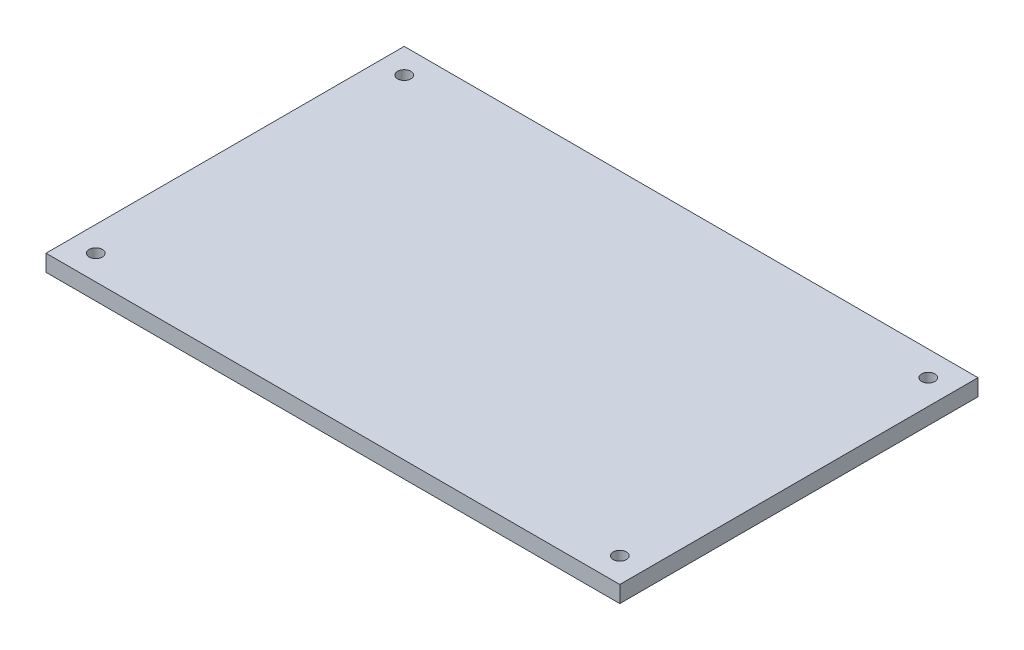
from build123d import *

# Parameters (mm, degrees)
SKETCH_1_W      = 173
SKETCH_1_H      = 108
SKETCH_1_R      = 2
EXTRUDE_1_DEPTH = 5
SKETCH_2_W      = 20
SKETCH_2_H      = 10.2
SKETCH_2_R      = 1.75
EXTRUDE_2_DEPTH = 30
FILLET_1_R      = 1
EXTRUDE_START   = 6.5
SKETCH_3_R      = 1.75
EXTRUDE_3_DEPTH = 6.5


with BuildPart() as part:
    # 草图1 → 凸台-拉伸1 (new body)
    with BuildSketch(Plane(origin=(0, 0, 0), x_dir=(1, 0, 0), z_dir=(0, 1, 0))):
        Rectangle(SKETCH_1_W, SKETCH_1_H)
        with Locations(Location((-79, 46.5, 0), (0, 0, 270))):
            Circle(SKETCH_1_R, mode=Mode.SUBTRACT)
        with Locations(Location((79, 46.5, 0), (0, 0, 90))):
            Circle(SKETCH_1_R, mode=Mode.SUBTRACT)
        with Locations(Location((79, -46.5, 0), (0, 0, 270))):
            Circle(SKETCH_1_R, mode=Mode.SUBTRACT)
        with Locations(Location((-79, -46.5, 0), (0, 0, 90))):
            Circle(SKETCH_1_R, mode=Mode.SUBTRACT)
    extrude(amount=EXTRUDE_1_DEPTH)

    # 草图2 → 凸台-拉伸2 (add)
    # profile 1 of 2: a face of its own
    with BuildSketch(Plane(origin=(0, 0, -54), x_dir=(-1, 0, 0), z_dir=(0, 0, -1))):
        with Locations((-32.5, -5.1)):
            Rectangle(SKETCH_2_W, SKETCH_2_H)
        with Locations((-32.5, -5.2)):
            Circle(SKETCH_2_R, mode=Mode.SUBTRACT)
    # profile 2 of 2: a face of its own
    with BuildSketch(Plane(origin=(0, 0, -54), x_dir=(-1, 0, 0), z_dir=(0, 0, -1))):
        with Locations((32.5, -5.1)):
            Rectangle(SKETCH_2_W, SKETCH_2_H)
        with Locations((32.5, -5.2)):
            Circle(SKETCH_2_R, mode=Mode.SUBTRACT)
    extrude(amount=-EXTRUDE_2_DEPTH)

    # 圆角1
    fillet_1_edges = [part.edges().sort_by_distance(p)[0] for p in [
        (42.5, -10.2, -39),
        (42.5, 0, -39),
        (22.5, 0, -39),
        (22.5, -10.2, -39),
        (-22.5, -10.2, -39),
        (-22.5, 0, -39),
        (-42.5, 0, -39),
        (-42.5, -10.2, -39),
    ]]
    fillet(fillet_1_edges, radius=FILLET_1_R)

    # 草图3 → 凸台-拉伸3 (add)
    # profile 1 of 2: a face of its own
    with BuildSketch(Plane.XY.offset(-24).offset(EXTRUDE_START)):
        with BuildLine():
            Line((23.5, -10.2), (41.5, -10.2))
            ThreePointArc((41.5, -10.2), (42.207106781, -9.907106781), (42.5, -9.2))
            Line((42.5, -9.2), (42.5, -1))
            ThreePointArc((42.5, -1), (42.792893219, -0.292893219), (43.5, 0))
            Line((43.5, 0), (21.5, 0))
            ThreePointArc((21.5, 0), (22.207106781, -0.292893219), (22.5, -1))
            Line((22.5, -1), (22.5, -9.2))
            ThreePointArc((22.5, -9.2), (22.792893219, -9.907106781), (23.5, -10.2))
        make_face()
        with Locations(Location((32.5, -5.2, 0), (0, 0, 180))):
            Circle(SKETCH_3_R, mode=Mode.SUBTRACT)
    # profile 2 of 2: a face of its own
    with BuildSketch(Plane.XY.offset(-24).offset(EXTRUDE_START)):
        with BuildLine():
            Line((-41.5, -10.2), (-23.5, -10.2))
            ThreePointArc((-23.5, -10.2), (-22.792893219, -9.907106781), (-22.5, -9.2))
            Line((-22.5, -9.2), (-22.5, -1))
            ThreePointArc((-22.5, -1), (-22.207106781, -0.292893219), (-21.5, 0))
            Line((-21.5, 0), (-43.5, 0))
            ThreePointArc((-43.5, 0), (-42.792893219, -0.292893219), (-42.5, -1))
            Line((-42.5, -1), (-42.5, -9.2))
            ThreePointArc((-42.5, -9.2), (-42.207106781, -9.907106781), (-41.5, -10.2))
        make_face()
        with Locations(Location((-32.5, -5.2, 0), (0, 0, 180))):
            Circle(SKETCH_3_R, mode=Mode.SUBTRACT)
    extrude(amount=-EXTRUDE_3_DEPTH)


solid = part.part
